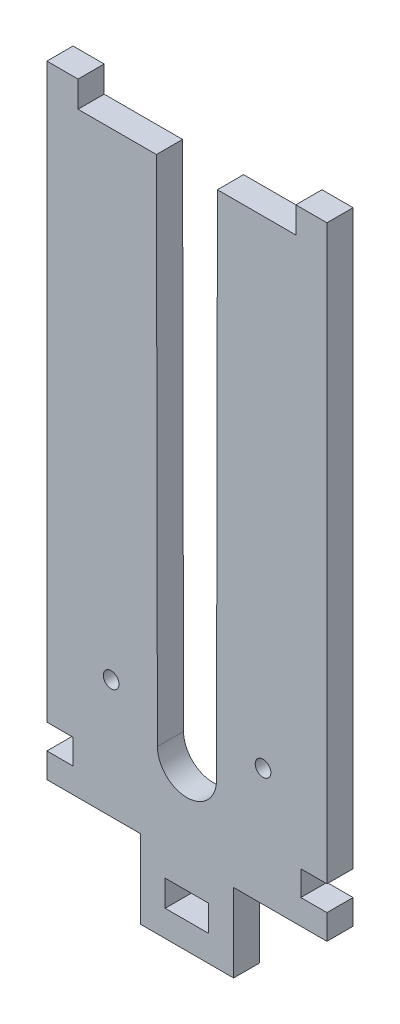
from build123d import *

# Parameters (mm, degrees)
SKETCH1_W           = 57.15
SKETCH1_H           = 127
BOSS_EXTRUDE3_DEPTH = 5.334
CUT_EXTRUDE2_DEPTH  = 140.368483008
SKETCH8_W           = 19.05
SKETCH8_H           = 5.334
CUT_EXTRUDE6_DEPTH  = 5.334
SKETCH8_5_W         = 19.05
SKETCH8_5_H         = 5.334
CUT_EXTRUDE7_DEPTH  = 5.334
SKETCH16_W          = 22.352
SKETCH16_H          = 5.334
BOSS_EXTRUDE4_DEPTH = 5.334
SKETCH32_W          = 16.002
SKETCH32_H          = 5.334
CUT_EXTRUDE13_DEPTH = 5.334
SKETCH35_R          = 1.6
CUT_EXTRUDE15_DEPTH = 145.245837417
SKETCH36_W          = 19.05
SKETCH36_H          = 5.334
BOSS_EXTRUDE5_DEPTH = 10.668
SKETCH37_W          = 8.89
SKETCH37_H          = 5.334
CUT_EXTRUDE16_DEPTH = 145.245837417
SKETCH38_W          = 5.334
SKETCH38_H          = 5.08
CUT_EXTRUDE17_DEPTH = 145.245837417


with BuildPart() as part:
    # Sketch1 → Boss-Extrude3 (new body)
    with BuildSketch(Plane.XY):
        with Locations((28.575, 63.5)):
            Rectangle(SKETCH1_W, SKETCH1_H)
    extrude(amount=BOSS_EXTRUDE3_DEPTH)

    # Sketch3 → Cut-Extrude2 (cut, through all)
    with BuildSketch(Plane.XY.offset(5.334)):
        with BuildLine():
            Line((34.601815113, 22.479), (34.798, 127))
            Line((34.798, 127), (22.352, 127))
            Line((22.352, 127), (22.548184887, 22.479))
            ThreePointArc((22.548184887, 22.479), (28.575, 16.452184887), (34.601815113, 22.479))
        make_face()
    extrude(amount=-CUT_EXTRUDE2_DEPTH, mode=Mode.SUBTRACT)

    # Sketch8 → Cut-Extrude6 (cut)
    with BuildSketch(Plane.XZ):
        with Locations((47.625, 2.667)):
            Rectangle(SKETCH8_W, SKETCH8_H)
    extrude(amount=-CUT_EXTRUDE6_DEPTH, mode=Mode.SUBTRACT)

    # Sketch8<5> → Cut-Extrude7 (cut)
    with BuildSketch(Plane.XZ):
        with Locations((47.625, 2.667)):
            Rectangle(SKETCH8_5_W, SKETCH8_5_H)
        with Locations((9.525, 2.667)):
            Rectangle(SKETCH8_5_W, SKETCH8_5_H)
    extrude(amount=-CUT_EXTRUDE7_DEPTH, mode=Mode.SUBTRACT)

    # Sketch16 → Boss-Extrude4 (add)
    with BuildSketch(Plane(origin=(0, 127, 0), x_dir=(1, 0, 0), z_dir=(0, 1, 0))):
        with Locations((45.974, -2.667)):
            Rectangle(SKETCH16_W, SKETCH16_H)
        with Locations((11.176, -2.667)):
            Rectangle(SKETCH16_W, SKETCH16_H)
    extrude(amount=BOSS_EXTRUDE4_DEPTH)

    # Sketch32 → Cut-Extrude13 (cut)
    with BuildSketch(Plane(origin=(0, 132.334, 0), x_dir=(1, 0, 0), z_dir=(0, 1, 0))):
        with Locations((14.351, -2.667)):
            Rectangle(SKETCH32_W, SKETCH32_H)
        with Locations((42.799, -2.667)):
            Rectangle(SKETCH32_W, SKETCH32_H)
    extrude(amount=-CUT_EXTRUDE13_DEPTH, mode=Mode.SUBTRACT)

    # Sketch35 → Cut-Extrude15 (cut, through all)
    with BuildSketch(Plane.XY.offset(5.334)):
        with Locations((13.107594454, 29.550730033)):
            Circle(SKETCH35_R)
        with Locations((44.107261808, 29.40711974)):
            Circle(SKETCH35_R)
    extrude(amount=-CUT_EXTRUDE15_DEPTH, mode=Mode.SUBTRACT)

    # Sketch36 → Boss-Extrude5 (add)
    with BuildSketch(Plane.XZ):
        with Locations((28.575, 2.667)):
            Rectangle(SKETCH36_W, SKETCH36_H)
    extrude(amount=BOSS_EXTRUDE5_DEPTH)

    # Sketch37 → Cut-Extrude16 (cut, through all)
    with BuildSketch(Plane(origin=(0, 0, 0), x_dir=(-1, 0, 0), z_dir=(0, 0, -1))):
        with Locations((-28.575, -2.667)):
            Rectangle(SKETCH37_W, SKETCH37_H)
    extrude(amount=-CUT_EXTRUDE16_DEPTH, mode=Mode.SUBTRACT)

    # Sketch38 → Cut-Extrude17 (cut, through all)
    with BuildSketch(Plane(origin=(0, 0, 0), x_dir=(-1, 0, 0), z_dir=(0, 0, -1))):
        with Locations((-54.483, 12.954)):
            Rectangle(SKETCH38_W, SKETCH38_H)
        with Locations((-2.667, 12.954)):
            Rectangle(SKETCH38_W, SKETCH38_H)
    extrude(amount=-CUT_EXTRUDE17_DEPTH, mode=Mode.SUBTRACT)


solid = part.part
